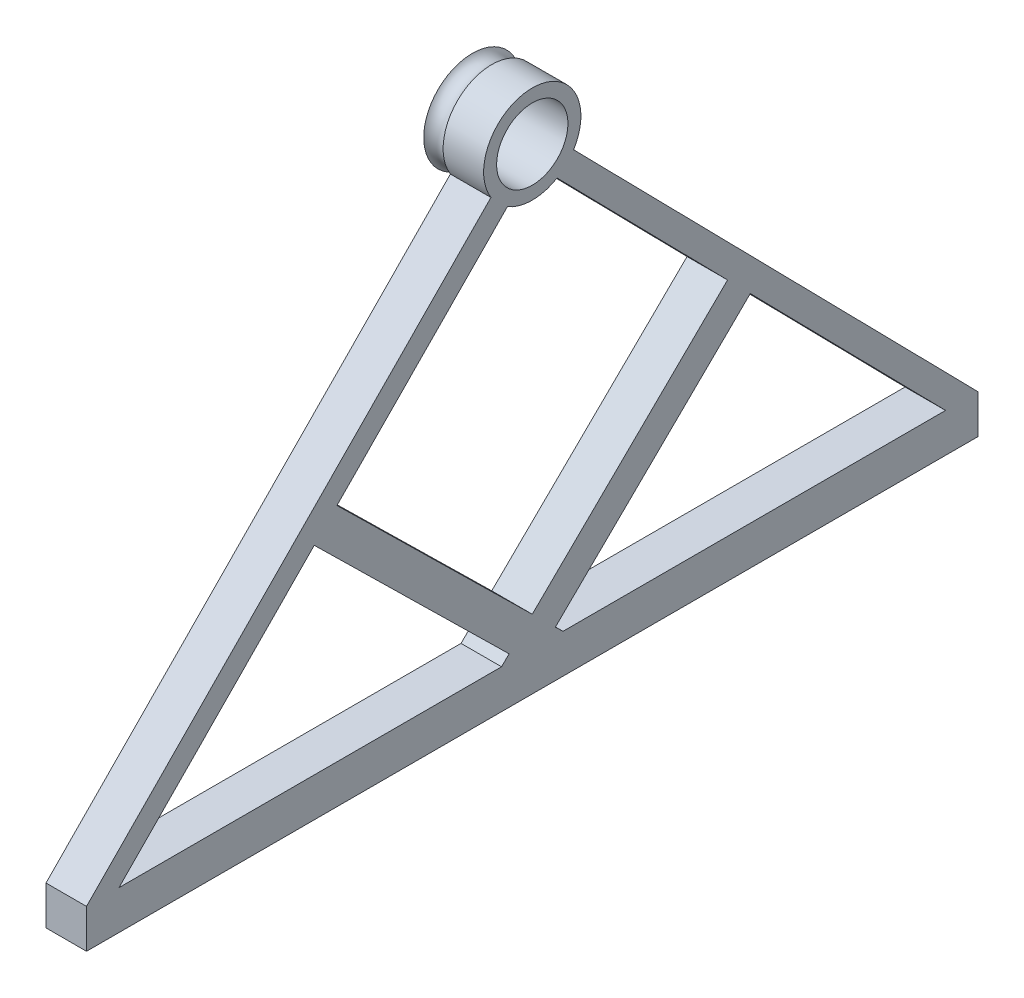
from build123d import *

# Parameters (mm, degrees)
SKETCH1_W               = 330
SKETCH1_H               = 275
SKETCH1_W_2             = 305
SKETCH1_H_2             = 250
BOSS_EXTRUDE4_DEPTH     = 12
BOSS_EXTRUDE6_DEPTH     = 12.5
BOSS_EXTRUDE7_DEPTH     = 12.5
SKETCH6_R               = 15
SKETCH6_R_2             = 11
BOSS_EXTRUDE8_DEPTH     = 12.5
SKETCH7_R               = 11
CUT_EXTRUDE2_DEPTH      = 383.003996993
BOSS_EXTRUDE9_REACH     = 283.371
SKETCH8_W               = 12.5
SKETCH8_H               = 10
BOSS_EXTRUDE10_REACH    = 283.371
SKETCH9_W               = 12.5
SKETCH9_H               = 10
SKETCH10_W              = 25
SKETCH10_H              = 25
BOSS_EXTRUDE11_DEPTH    = 12.5
SKETCH12_W              = 280.956709722
SKETCH12_H              = 169.506953284
CUT_EXTRUDE3_DEPTH      = 311
CUT_EXTRUDE4_DEPTH      = 12
CUT_EXTRUDE4_DEPTH_BACK = 6.5
SKETCH13_W              = 294.886301965
SKETCH13_H              = 76.884210059


with BuildPart() as part:
    # Sketch1 → Boss-Extrude4 (new body)
    with BuildSketch(Plane(origin=(0, 0, 0), x_dir=(1, 0, 0), z_dir=(0, 1, 0))):
        Rectangle(SKETCH1_W, SKETCH1_H)
        Rectangle(SKETCH1_W_2, SKETCH1_H_2, mode=Mode.SUBTRACT)
    extrude(amount=BOSS_EXTRUDE4_DEPTH)

    # Sketch2 → Boss-Extrude6 (add)
    with BuildSketch(Plane(origin=(165, 0, 0), x_dir=(0, 0, -1), z_dir=(1, 0, 0))):
        Polygon((0, 152), (-137.5, 12), (-127.5, 12), (0, 141.818181818), (127.5, 12), (137.5, 12), align=None)
    extrude(amount=-BOSS_EXTRUDE6_DEPTH)

    # Sketch5 → Boss-Extrude7 (add)
    with BuildSketch(Plane.ZY.offset(165)):
        Polygon((0, 152), (-137.5, 12), (-127.5, 12), (0, 141.818181818), (127.5, 12), (137.5, 12), align=None)
    extrude(amount=-BOSS_EXTRUDE7_DEPTH)

    # Sketch6 → Boss-Extrude8 (add)
    with BuildSketch(Plane.ZY.offset(-152.5)):
        with Locations((0, 146.909090909)):
            Circle(SKETCH6_R)
        with Locations((0, 146.909090909)):
            Circle(SKETCH6_R_2, mode=Mode.SUBTRACT)
    extrude(amount=-BOSS_EXTRUDE8_DEPTH)

    # Sketch7 → Cut-Extrude2 (cut, through all)
    with BuildSketch(Plane.ZY.offset(-152.5)):
        with Locations((0, 146.909090909)):
            Circle(SKETCH7_R)
    extrude(amount=-CUT_EXTRUDE2_DEPTH, mode=Mode.SUBTRACT)

    # Boss-Extrude9: up to this plane
    boss_extrude9_end = Plane(origin=(0, 12, 0), z_dir=(0, -1, 0))
    # Sketch8 → Boss-Extrude9 (add, up to the surface)
    with BuildSketch(Plane(origin=(0, 69.631553319, 70.897581561), x_dir=(-1, 0, 0), z_dir=(0, -0.7007080148842544, -0.7134481606094221)), mode=Mode.PRIVATE) as boss_extrude9_sk1:
        with Locations((-158.75, 10.200513494)):
            Rectangle(SKETCH8_W, SKETCH8_H)
    boss_extrude9_tool1 = split(extrude(boss_extrude9_sk1.sketch, amount=BOSS_EXTRUDE9_REACH, mode=Mode.PRIVATE), bisect_by=boss_extrude9_end, keep=Keep.BOTH, mode=Mode.PRIVATE)
    add(boss_extrude9_tool1.solids().sort_by_distance((158.75, 76.909091, 63.75))[0])
    # Sketch8 → Boss-Extrude9 (add, up to the surface)
    with BuildSketch(Plane(origin=(0, 69.631553319, 70.897581561), x_dir=(-1, 0, 0), z_dir=(0, -0.7007080148842544, -0.7134481606094221)), mode=Mode.PRIVATE) as boss_extrude9_sk2:
        with Locations((158.75, 10.200513494)):
            Rectangle(SKETCH8_W, SKETCH8_H)
    boss_extrude9_tool2 = split(extrude(boss_extrude9_sk2.sketch, amount=BOSS_EXTRUDE9_REACH, mode=Mode.PRIVATE), bisect_by=boss_extrude9_end, keep=Keep.BOTH, mode=Mode.PRIVATE)
    add(boss_extrude9_tool2.solids().sort_by_distance((-158.75, 76.909091, 63.75))[0])

    # Boss-Extrude10: up to this plane
    boss_extrude10_end = Plane(origin=(0, 12, 0), z_dir=(0, -1, 0))
    # Sketch9 → Boss-Extrude10 (add, up to the surface)
    with BuildSketch(Plane(origin=(0, 69.631553319, -70.897581561), x_dir=(1, 0, 0), z_dir=(0, -0.7007080148842544, 0.7134481606094221)), mode=Mode.PRIVATE) as boss_extrude10_sk1:
        with Locations((-158.75, 10.200513494)):
            Rectangle(SKETCH9_W, SKETCH9_H)
    boss_extrude10_tool1 = split(extrude(boss_extrude10_sk1.sketch, amount=BOSS_EXTRUDE10_REACH, mode=Mode.PRIVATE), bisect_by=boss_extrude10_end, keep=Keep.BOTH, mode=Mode.PRIVATE)
    add(boss_extrude10_tool1.solids().sort_by_distance((-158.75, 76.909091, -63.75))[0])
    # Sketch9 → Boss-Extrude10 (add, up to the surface)
    with BuildSketch(Plane(origin=(0, 69.631553319, -70.897581561), x_dir=(1, 0, 0), z_dir=(0, -0.7007080148842544, 0.7134481606094221)), mode=Mode.PRIVATE) as boss_extrude10_sk2:
        with Locations((158.75, 10.200513494)):
            Rectangle(SKETCH9_W, SKETCH9_H)
    boss_extrude10_tool2 = split(extrude(boss_extrude10_sk2.sketch, amount=BOSS_EXTRUDE10_REACH, mode=Mode.PRIVATE), bisect_by=boss_extrude10_end, keep=Keep.BOTH, mode=Mode.PRIVATE)
    add(boss_extrude10_tool2.solids().sort_by_distance((158.75, 76.909091, -63.75))[0])

    # Sketch10 → Boss-Extrude11 (add)
    with BuildSketch(Plane(origin=(-152.5, 0, 0), x_dir=(0, 0, -1), z_dir=(1, 0, 0))):
        with Locations((0, 146.909090909)):
            Rectangle(SKETCH10_W, SKETCH10_H)
    extrude(amount=-BOSS_EXTRUDE11_DEPTH)

    # Sketch11 → Revolve1 (revolve)
    with BuildSketch(Plane.XY, mode=Mode.PRIVATE) as revolve1_sk:
        with BuildLine():
            Line((152.5, 157.909090909), (152.5, 161.909090909))
            ThreePointArc((152.5, 161.909090909), (149.508436085, 160.260408588), (146.516872171, 161.909090909))
            Line((146.516872171, 161.909090909), (146.516872171, 157.909090909))
            Line((146.516872171, 157.909090909), (152.5, 157.909090909))
        make_face()
    revolve(revolve1_sk.sketch.rotate(Axis((152.5, 146.909090909, 0), (-1, 0, 0)), 270), axis=Axis((152.5, 146.909090909, 0), (-1, 0, 0)))

    # Sketch12 → Cut-Extrude3 (cut)
    with BuildSketch(Plane.ZY.offset(165)):
        with Locations((2.978354861, 84.753476642)):
            Rectangle(SKETCH12_W, SKETCH12_H)
    extrude(amount=-CUT_EXTRUDE3_DEPTH, mode=Mode.SUBTRACT)

    # Sketch13 → Cut-Extrude4 (cut, two sides: drawn at the far end of the back side and taken through both)
    with BuildSketch(Plane.ZY.offset(-146).offset(-CUT_EXTRUDE4_DEPTH_BACK)):
        with Locations((9.943150983, 38.44210503)):
            Rectangle(SKETCH13_W, SKETCH13_H)
    extrude(amount=CUT_EXTRUDE4_DEPTH + CUT_EXTRUDE4_DEPTH_BACK, mode=Mode.SUBTRACT)


solid = part.part
